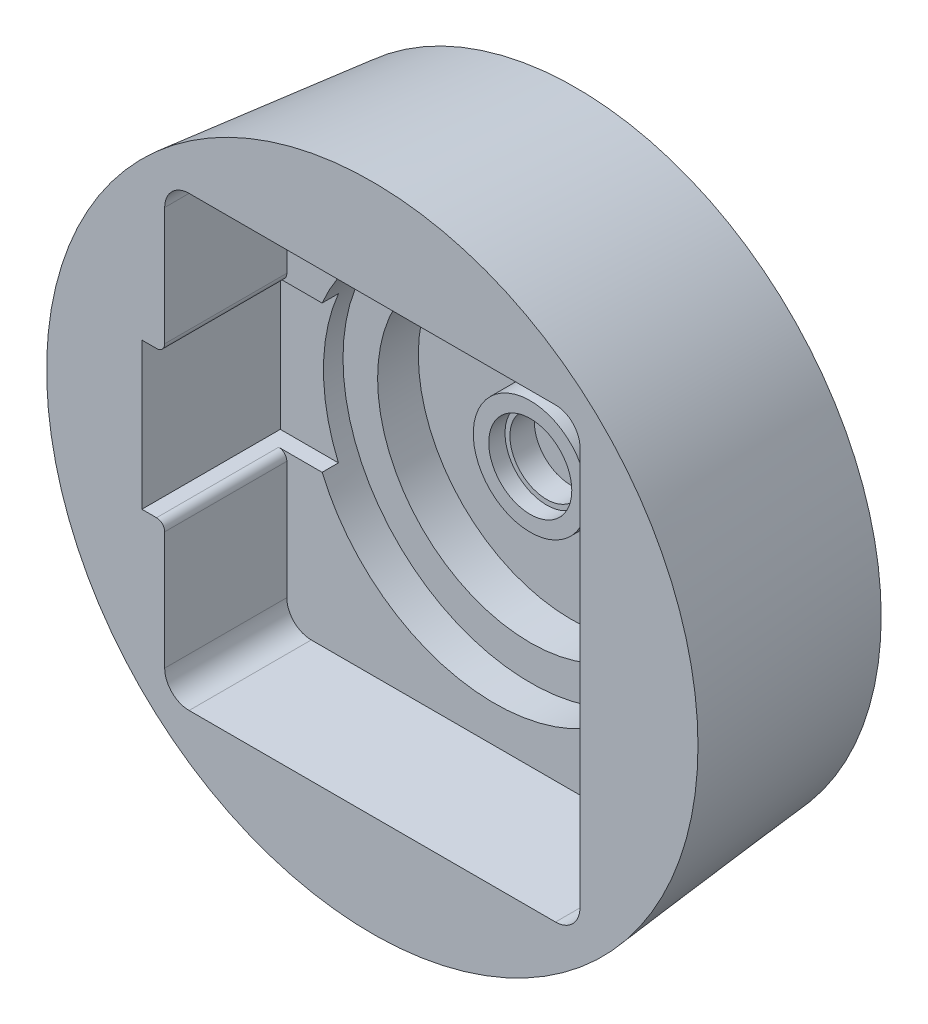
from build123d import *

# Parameters (mm, degrees)
SKETCH4_W           = 51
SKETCH4_H           = 55
CUT_EXTRUDE1_DEPTH  = 15
FILLET1_R           = 3
SKETCH7_W           = 10
SKETCH7_H           = 18
CUT_EXTRUDE5_DEPTH  = 17
SKETCH8_R           = 23
CUT_EXTRUDE6_DEPTH  = 4.4
SKETCH10_R          = 18.75
CUT_EXTRUDE7_DEPTH  = 5
SKETCH11_R          = 7
BOSS_EXTRUDE3_DEPTH = 5
SKETCH12_R          = 5.1
CUT_EXTRUDE8_DEPTH  = 2
SKETCH13_R          = 4.5
CUT_EXTRUDE9_DEPTH  = 3
FILLET2_R           = 1


with BuildPart() as part:
    # Sketch2 → Revolve1 (revolve)
    with BuildSketch(Plane(origin=(0, 0, 0), x_dir=(1, 0, 0), z_dir=(0, 1, 0))):
        Polygon((0, 25), (37.5, 25), (40, 0), (0, 0), align=None)
    revolve(axis=Axis((0, 0, 0), (0, 0, -1)))

    # Sketch4 → Cut-Extrude1 (cut)
    with BuildSketch(Plane.XY):
        Rectangle(SKETCH4_W, SKETCH4_H)
    extrude(amount=-CUT_EXTRUDE1_DEPTH, mode=Mode.SUBTRACT)

    # Fillet1
    fillet1_edges = [part.edges().sort_by_distance(p)[0] for p in [
        (25.5, 27.5, -7.5),
        (25.5, -27.5, -7.5),
        (-25.5, -27.5, -7.5),
        (-25.5, 27.5, -7.5),
    ]]
    fillet(fillet1_edges, radius=FILLET1_R)

    # Sketch7 → Cut-Extrude5 (cut)
    with BuildSketch(Plane.XY):
        with Locations((-23.3, 0)):
            Rectangle(SKETCH7_W, SKETCH7_H)
    extrude(amount=-CUT_EXTRUDE5_DEPTH, mode=Mode.SUBTRACT)

    # Sketch8 → Cut-Extrude6 (cut)
    with BuildSketch(Plane.XY.offset(-15)):
        Circle(SKETCH8_R)
    extrude(amount=-CUT_EXTRUDE6_DEPTH, mode=Mode.SUBTRACT)

    # Sketch10 → Cut-Extrude7 (cut)
    with BuildSketch(Plane.XY.offset(-19.4)):
        Circle(SKETCH10_R)
    extrude(amount=-CUT_EXTRUDE7_DEPTH, mode=Mode.SUBTRACT)

    # Sketch11 → Boss-Extrude3 (add)
    with BuildSketch(Plane.XY.offset(-24.4)):
        Circle(SKETCH11_R)
    extrude(amount=BOSS_EXTRUDE3_DEPTH)

    # Sketch12 → Cut-Extrude8 (cut)
    with BuildSketch(Plane.XY.offset(-19.4)):
        Circle(SKETCH12_R)
    extrude(amount=-CUT_EXTRUDE8_DEPTH, mode=Mode.SUBTRACT)

    # Sketch13 → Cut-Extrude9 (cut)
    with BuildSketch(Plane.XY.offset(-21.4)):
        Circle(SKETCH13_R)
    extrude(amount=-CUT_EXTRUDE9_DEPTH, mode=Mode.SUBTRACT)

    # Fillet2
    fillet2_edges = [part.edges().sort_by_distance(p)[0] for p in [
        (-25.5, 9, -7.5),
        (-25.5, -9, -7.5),
    ]]
    fillet(fillet2_edges, radius=FILLET2_R)


solid = part.part
